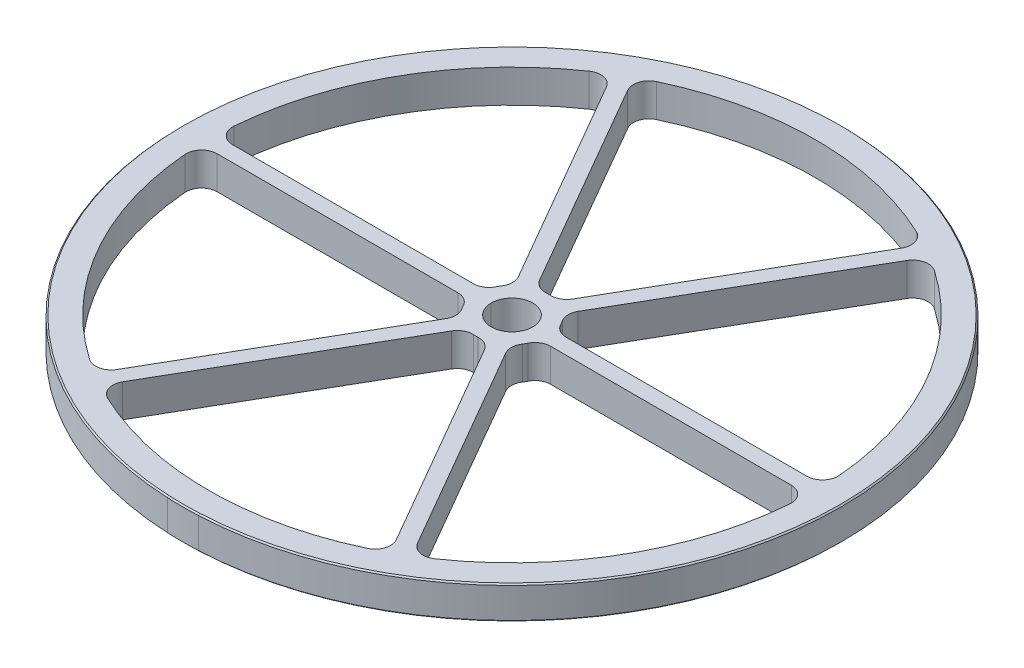
from build123d import *

# Parameters (mm, degrees)
SKETCH1_R           = 63.5
SKETCH1_R_2         = 4
BOSS_EXTRUDE3_DEPTH = 6.35
CHAMFER2_SIZE       = 0.25


with BuildPart() as part:
    # Sketch1 → Boss-Extrude3 (new body)
    with BuildSketch(Plane(origin=(0, 0, 0), x_dir=(1, 0, 0), z_dir=(0, 1, 0))):
        Circle(SKETCH1_R)
        Circle(SKETCH1_R_2, mode=Mode.SUBTRACT)
        with BuildLine():
            Line((-3.166104669, 8.483854149), (-26.359595266, 48.656158268))
            ThreePointArc((-26.359595266, 48.656158268), (-26.62540639, 51.049550304), (-25.04592549, 52.867301958))
            ThreePointArc((-25.04592549, 52.867301958), (0, 58.5), (25.04592549, 52.867301958))
            ThreePointArc((25.04592549, 52.867301958), (26.62540639, 51.049550304), (26.359595266, 48.656158268))
            Line((26.359595266, 48.656158268), (3.166104669, 8.483854149))
            ThreePointArc((3.166104669, 8.483854149), (1.993604002, 7.344207512), (0.39761992, 6.988697904))
            ThreePointArc((0.39761992, 6.988697904), (0, 7), (-0.39761992, 6.988697904))
            ThreePointArc((-0.39761992, 6.988697904), (-1.993604002, 7.344207512), (-3.166104669, 8.483854149))
        make_face(mode=Mode.SUBTRACT)
        with BuildLine():
            Line((5.764180881, 6.983854149), (28.957671478, 47.156158268))
            ThreePointArc((28.957671478, 47.156158268), (30.89750422, 48.583053472), (33.26146378, 48.124058715))
            ThreePointArc((33.26146378, 48.124058715), (50.662486121, 29.25), (58.30738927, 4.743243243))
            ThreePointArc((58.30738927, 4.743243243), (57.52291061, 2.466496832), (55.317266744, 1.5))
            Line((55.317266744, 1.5), (8.93028555, 1.5))
            ThreePointArc((8.93028555, 1.5), (7.357072277, 1.945592045), (6.251199885, 3.15))
            ThreePointArc((6.251199885, 3.15), (6.062177826, 3.5), (5.853579964, 3.838697904))
            ThreePointArc((5.853579964, 3.838697904), (5.363468275, 5.398615467), (5.764180881, 6.983854149))
        make_face(mode=Mode.SUBTRACT)
        with BuildLine():
            Line((8.93028555, -1.5), (55.317266744, -1.5))
            ThreePointArc((55.317266744, -1.5), (57.52291061, -2.466496832), (58.30738927, -4.743243243))
            ThreePointArc((58.30738927, -4.743243243), (50.662486121, -29.25), (33.26146378, -48.124058715))
            ThreePointArc((33.26146378, -48.124058715), (30.89750422, -48.583053472), (28.957671478, -47.156158268))
            Line((28.957671478, -47.156158268), (5.764180881, -6.983854149))
            ThreePointArc((5.764180881, -6.983854149), (5.363468275, -5.398615467), (5.853579964, -3.838697904))
            ThreePointArc((5.853579964, -3.838697904), (6.062177826, -3.5), (6.251199885, -3.15))
            ThreePointArc((6.251199885, -3.15), (7.357072277, -1.945592045), (8.93028555, -1.5))
        make_face(mode=Mode.SUBTRACT)
        with BuildLine():
            Line((3.166104669, -8.483854149), (26.359595266, -48.656158268))
            ThreePointArc((26.359595266, -48.656158268), (26.62540639, -51.049550304), (25.04592549, -52.867301958))
            ThreePointArc((25.04592549, -52.867301958), (0, -58.5), (-25.04592549, -52.867301958))
            ThreePointArc((-25.04592549, -52.867301958), (-26.62540639, -51.049550304), (-26.359595266, -48.656158268))
            Line((-26.359595266, -48.656158268), (-3.166104669, -8.483854149))
            ThreePointArc((-3.166104669, -8.483854149), (-1.993604002, -7.344207512), (-0.39761992, -6.988697904))
            ThreePointArc((-0.39761992, -6.988697904), (0, -7), (0.39761992, -6.988697904))
            ThreePointArc((0.39761992, -6.988697904), (1.993604002, -7.344207512), (3.166104669, -8.483854149))
        make_face(mode=Mode.SUBTRACT)
        with BuildLine():
            Line((-5.764180881, -6.983854149), (-28.957671478, -47.156158268))
            ThreePointArc((-28.957671478, -47.156158268), (-30.89750422, -48.583053472), (-33.26146378, -48.124058715))
            ThreePointArc((-33.26146378, -48.124058715), (-50.662486121, -29.25), (-58.30738927, -4.743243243))
            ThreePointArc((-58.30738927, -4.743243243), (-57.52291061, -2.466496832), (-55.317266744, -1.5))
            Line((-55.317266744, -1.5), (-8.93028555, -1.5))
            ThreePointArc((-8.93028555, -1.5), (-7.357072277, -1.945592045), (-6.251199885, -3.15))
            ThreePointArc((-6.251199885, -3.15), (-6.062177826, -3.5), (-5.853579964, -3.838697904))
            ThreePointArc((-5.853579964, -3.838697904), (-5.363468275, -5.398615467), (-5.764180881, -6.983854149))
        make_face(mode=Mode.SUBTRACT)
        with BuildLine():
            Line((-8.93028555, 1.5), (-55.317266744, 1.5))
            ThreePointArc((-55.317266744, 1.5), (-57.52291061, 2.466496832), (-58.30738927, 4.743243243))
            ThreePointArc((-58.30738927, 4.743243243), (-50.662486121, 29.25), (-33.26146378, 48.124058715))
            ThreePointArc((-33.26146378, 48.124058715), (-30.89750422, 48.583053472), (-28.957671478, 47.156158268))
            Line((-28.957671478, 47.156158268), (-5.764180881, 6.983854149))
            ThreePointArc((-5.764180881, 6.983854149), (-5.363468275, 5.398615467), (-5.853579964, 3.838697904))
            ThreePointArc((-5.853579964, 3.838697904), (-6.062177826, 3.5), (-6.251199885, 3.15))
            ThreePointArc((-6.251199885, 3.15), (-7.357072277, 1.945592045), (-8.93028555, 1.5))
        make_face(mode=Mode.SUBTRACT)
    extrude(amount=BOSS_EXTRUDE3_DEPTH)

    # Chamfer2
    chamfer2_edges = [part.edges().sort_by_distance(p)[0] for p in [
        (-63.5, 6.35, 0),
        (-63.5, 6.35, 0),
        (-63.5, 6.35, 0),
        (-63.5, 6.35, 0),
        (-63.5, 0, 0),
        (-63.5, 0, 0),
        (-63.5, 0, 0),
        (-63.5, 0, 0),
    ]]
    chamfer(chamfer2_edges, length=CHAMFER2_SIZE)


solid = part.part
